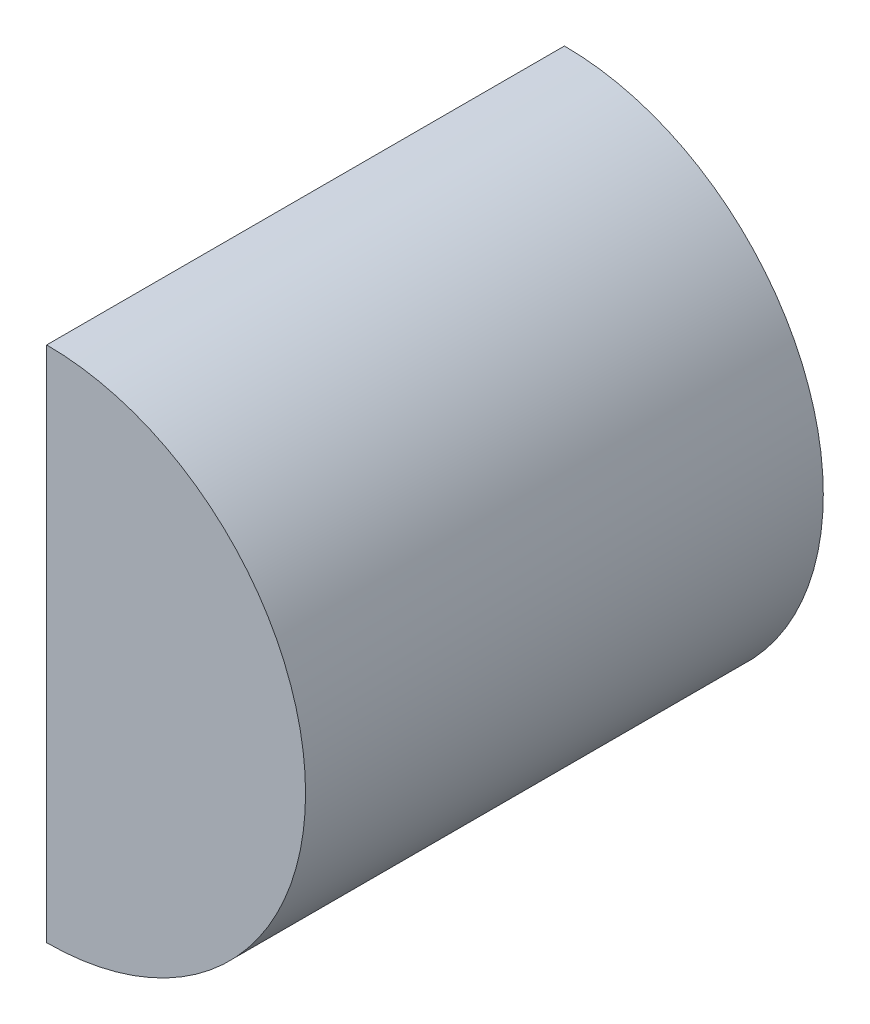
from build123d import *

# Parameters (mm, degrees)
SALIENTE_EXTRUIR1_DEPTH = 50
CROQUIS2_R              = 5
CORTAR_EXTRUIR1_DEPTH   = 10


with BuildPart() as part:
    # Croquis1 → Saliente-Extruir1 (new body)
    with BuildSketch(Plane.XY):
        with BuildLine():
            Line((0, 25), (0, -25))
            ThreePointArc((0, -25), (25, 0), (0, 25))
        make_face()
    extrude(amount=SALIENTE_EXTRUIR1_DEPTH)

    # Croquis2 → Cortar-Extruir1 (cut)
    with BuildSketch(Plane(origin=(0, 0, 0), x_dir=(-1, 0, 0), z_dir=(0, 0, -1))):
        with Locations((-10.550443683, 0)):
            Circle(CROQUIS2_R)
    extrude(amount=-CORTAR_EXTRUIR1_DEPTH, mode=Mode.SUBTRACT)


solid = part.part
